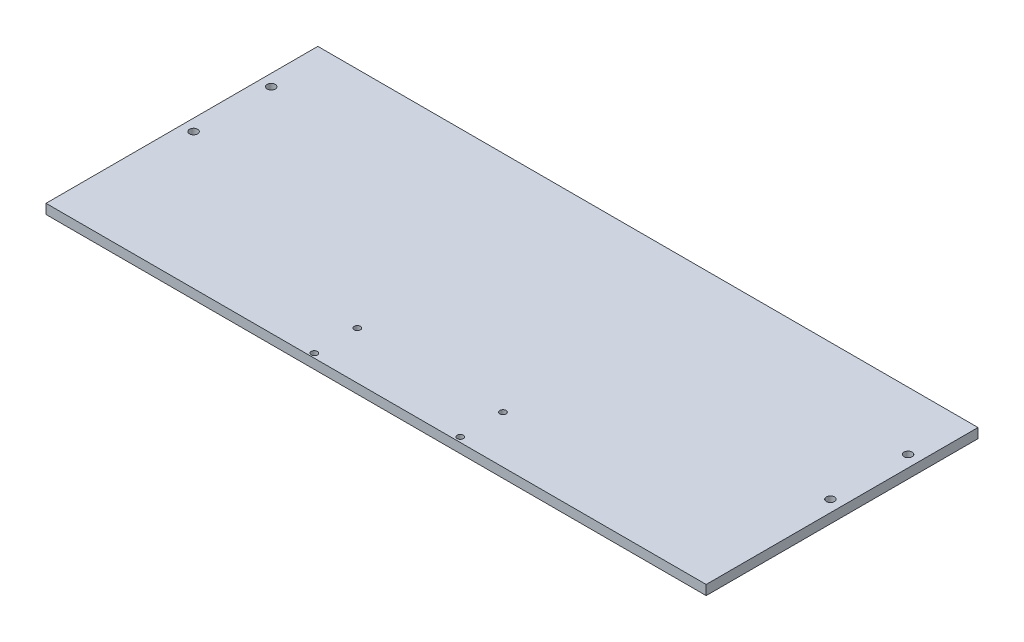
from build123d import *

# Parameters (mm, degrees)
SKETCH_1_W      = 340
SKETCH_1_H      = 140
SKETCH_1_R      = 2.1
SKETCH_1_R_2    = 1.6
EXTRUDE_1_DEPTH = 5


with BuildPart() as part:
    # 草图1 → 凸台-拉伸1 (new body)
    with BuildSketch(Plane(origin=(0, 0, 0), x_dir=(1, 0, 0), z_dir=(0, 1, 0))):
        Rectangle(SKETCH_1_W, SKETCH_1_H)
        with Locations(Location((164, 40, 0), (0, 0, 270))):
            Circle(SKETCH_1_R, mode=Mode.SUBTRACT)
        with Locations(Location((164, 0, 0), (0, 0, 270))):
            Circle(SKETCH_1_R, mode=Mode.SUBTRACT)
        with Locations(Location((-164, 40, 0), (0, 0, 270))):
            Circle(SKETCH_1_R, mode=Mode.SUBTRACT)
        with Locations(Location((-164, 0, 0), (0, 0, 270))):
            Circle(SKETCH_1_R, mode=Mode.SUBTRACT)
        with Locations(Location((-34.155699002, -45.5, 0), (0, 0, 270))):
            Circle(SKETCH_1_R_2, mode=Mode.SUBTRACT)
        with Locations(Location((-34.055699002, -67.748331477, 0), (0, 0, 270))):
            Circle(SKETCH_1_R_2, mode=Mode.SUBTRACT)
        with Locations(Location((40.844300998, -67.5, 0), (0, 0, 270))):
            Circle(SKETCH_1_R_2, mode=Mode.SUBTRACT)
        with Locations(Location((40.844300998, -45.5, 0), (0, 0, 270))):
            Circle(SKETCH_1_R_2, mode=Mode.SUBTRACT)
    extrude(amount=EXTRUDE_1_DEPTH)


solid = part.part
